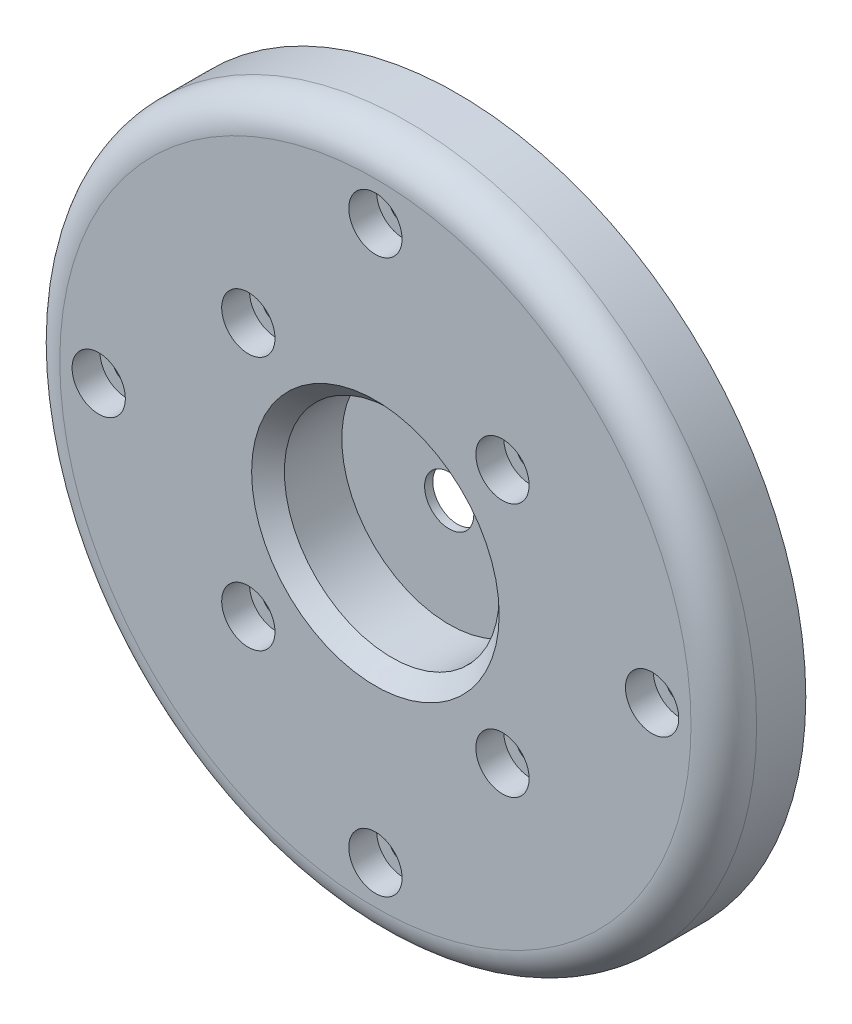
from build123d import *

# Parameters (mm, degrees)
SKIZZE3_R                       = 42.5
AUFSATZ_LINEAR_AUSTRAGEN1_DEPTH = 10
SKIZZE4_R                       = 3
SCHNITT_LINEAR_AUSTRAGEN1_DEPTH = 10
SKIZZE5_R                       = 3.25
SCHNITT_LINEAR_AUSTRAGEN3_DEPTH = 3.4
SKIZZE6_R                       = 1.7
SCHNITT_LINEAR_AUSTRAGEN4_DEPTH = 6.6
KREISMUSTER1_COUNT              = 4
SKIZZE7_R                       = 13.1
SCHNITT_LINEAR_AUSTRAGEN5_DEPTH = 9
VERRUNDUNG1_R                   = 4
FASE1_SIZE                      = 2


with BuildPart() as part:
    # Skizze3 → Aufsatz-Linear austragen1 (new body)
    with BuildSketch(Plane.XY):
        Circle(SKIZZE3_R)
    extrude(amount=AUFSATZ_LINEAR_AUSTRAGEN1_DEPTH)

    # Skizze4 → Schnitt-Linear austragen1 (cut)
    with BuildSketch(Plane.XY.offset(10)):
        Circle(SKIZZE4_R)
    extrude(amount=-SCHNITT_LINEAR_AUSTRAGEN1_DEPTH, mode=Mode.SUBTRACT)

    # Skizze5 → Schnitt-Linear austragen3 (cut)
    with BuildSketch(Plane.XY.offset(10)):
        with Locations((-15.5, 15.5)):
            Circle(SKIZZE5_R)
        with Locations((-33.75, 0)):
            Circle(SKIZZE5_R)
    schnitt_linear_austragen3 = extrude(amount=-SCHNITT_LINEAR_AUSTRAGEN3_DEPTH, mode=Mode.SUBTRACT)

    # Skizze6 → Schnitt-Linear austragen4 (cut)
    with BuildSketch(Plane.XY.offset(6.6)):
        with Locations((-15.5, 15.5)):
            Circle(SKIZZE6_R)
        with Locations((-33.75, 0)):
            Circle(SKIZZE6_R)
    schnitt_linear_austragen4 = extrude(amount=-SCHNITT_LINEAR_AUSTRAGEN4_DEPTH, mode=Mode.SUBTRACT)

    # Kreismuster1: Schnitt-Linear austragen3, Schnitt-Linear austragen4 ×4 about axis
    kreismuster1_axis = Axis((0, 0, 0), (0, 0, 1))
    add([schnitt_linear_austragen3.rotate(kreismuster1_axis, i * 360 / KREISMUSTER1_COUNT) for i in range(1, KREISMUSTER1_COUNT)], mode=Mode.SUBTRACT)
    add([schnitt_linear_austragen4.rotate(kreismuster1_axis, i * 360 / KREISMUSTER1_COUNT) for i in range(1, KREISMUSTER1_COUNT)], mode=Mode.SUBTRACT)

    # Skizze7 → Schnitt-Linear austragen5 (cut)
    with BuildSketch(Plane.XY.offset(10)):
        Circle(SKIZZE7_R)
    extrude(amount=-SCHNITT_LINEAR_AUSTRAGEN5_DEPTH, mode=Mode.SUBTRACT)

    # Verrundung1
    verrundung1_edges = [part.edges().sort_by_distance(p)[0] for p in [
        (-42.5, 0, 10),
    ]]
    fillet(verrundung1_edges, radius=VERRUNDUNG1_R)

    # Fase1
    fase1_edges = [part.edges().sort_by_distance(p)[0] for p in [
        (-13.1, 0, 10),
    ]]
    chamfer(fase1_edges, length=FASE1_SIZE)


solid = part.part
